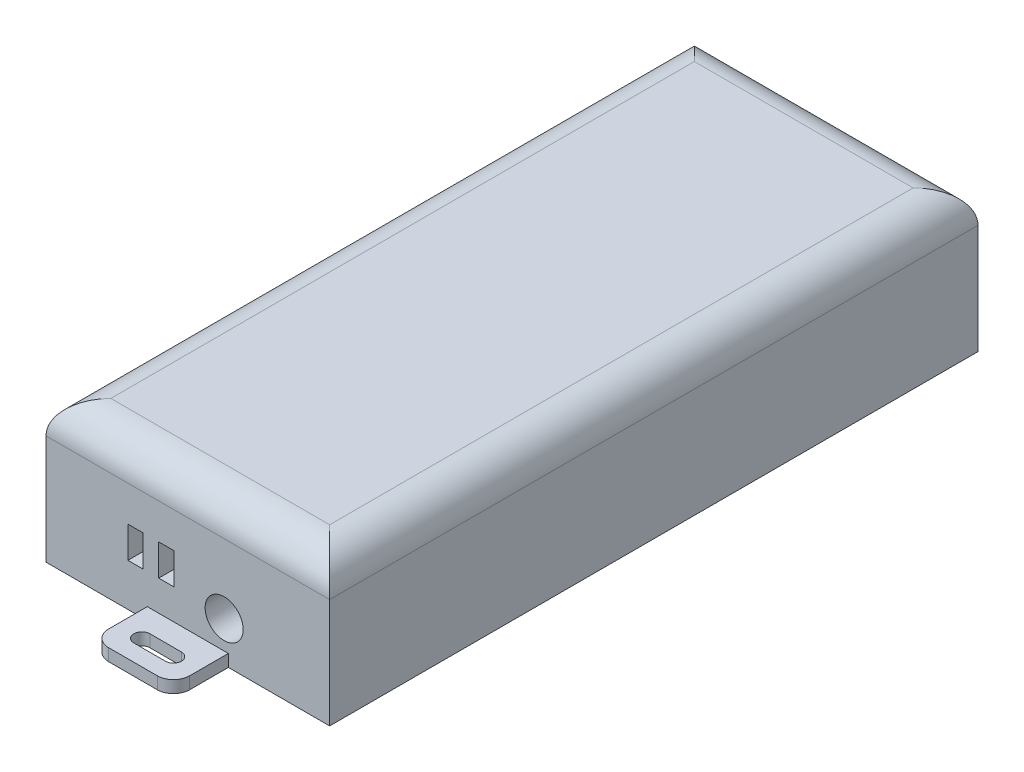
from build123d import *

# Parameters (mm, degrees)
SKETCH1_W           = 44.45
SKETCH1_H           = 101.6
BOSS_EXTRUDE1_DEPTH = 22.225
FILLET1_R           = 5.08
SKETCH2_R           = 2.981516586
CUT_EXTRUDE1_DEPTH  = 12.7
SKETCH3_W           = 2.38773998
SKETCH3_H           = 4.914706725
SKETCH3_W_2         = 2.387739981
CUT_EXTRUDE2_DEPTH  = 7.62
SKETCH4_W           = 3.327455713
SKETCH4_H           = 5.359264955
SKETCH4_W_2         = 3.327455714
CUT_EXTRUDE3_DEPTH  = 7.62
BOSS_EXTRUDE2_DEPTH = 1.905


with BuildPart() as part:
    # Sketch1 → Boss-Extrude1 (new body)
    with BuildSketch(Plane(origin=(0, 0, 0), x_dir=(1, 0, 0), z_dir=(0, 1, 0))):
        with Locations((22.225, 50.8)):
            Rectangle(SKETCH1_W, SKETCH1_H)
    extrude(amount=BOSS_EXTRUDE1_DEPTH)

    # Fillet1
    fillet1_edges = [part.edges().sort_by_distance(p)[0] for p in [
        (44.45, 22.225, -50.8),
        (22.225, 22.225, -101.6),
        (0, 22.225, -50.8),
        (22.225, 22.225, 0),
    ]]
    fillet(fillet1_edges, radius=FILLET1_R)

    # Sketch2 → Cut-Extrude1 (cut)
    with BuildSketch(Plane.XY):
        with Locations((27.915098323, 6.294196756)):
            Circle(SKETCH2_R)
    extrude(amount=-CUT_EXTRUDE1_DEPTH, mode=Mode.SUBTRACT)

    # Sketch3 → Cut-Extrude2 (cut)
    with BuildSketch(Plane.XY):
        with Locations((14.031826574, 9.129741005)):
            Rectangle(SKETCH3_W, SKETCH3_H)
        with Locations((18.859604577, 9.129741005)):
            Rectangle(SKETCH3_W_2, SKETCH3_H)
    extrude(amount=-CUT_EXTRUDE2_DEPTH, mode=Mode.SUBTRACT)

    # Sketch4 → Cut-Extrude3 (cut)
    with BuildSketch(Plane(origin=(0, 0, -101.6), x_dir=(-1, 0, 0), z_dir=(0, 0, -1))):
        with Locations((-29.15965328, 6.872202453)):
            Rectangle(SKETCH4_W, SKETCH4_H)
        with Locations((-24.536551093, 6.872202453)):
            Rectangle(SKETCH4_W_2, SKETCH4_H)
        with Locations((-19.913448907, 6.872202453)):
            Rectangle(SKETCH4_W_2, SKETCH4_H)
        with Locations((-15.290346721, 6.872202453)):
            Rectangle(SKETCH4_W, SKETCH4_H)
    extrude(amount=-CUT_EXTRUDE3_DEPTH, mode=Mode.SUBTRACT)

    # Sketch5 → Boss-Extrude2 (add)
    with BuildSketch(Plane.XZ):
        with BuildLine():
            Line((15.875, 0), (15.875, 6.058263516))
            ThreePointArc((15.875, 6.058263516), (16.618948776, 7.85431474), (18.415, 8.598263516))
            Line((18.415, 8.598263516), (26.035, 8.598263516))
            ThreePointArc((26.035, 8.598263516), (27.831051224, 7.85431474), (28.575, 6.058263516))
            Line((28.575, 6.058263516), (28.575, 0))
            Line((28.575, 0), (15.875, 0))
        make_face()
        with BuildLine():
            Line((19.751425895, 5.984747985), (24.698574105, 5.984747985))
            ThreePointArc((24.698574105, 5.984747985), (25.952772297, 4.730549793), (24.698574105, 3.476351601))
            Line((24.698574105, 3.476351601), (19.751425895, 3.476351601))
            ThreePointArc((19.751425895, 3.476351601), (18.497227703, 4.730549793), (19.751425895, 5.984747985))
        make_face(mode=Mode.SUBTRACT)
    boss_extrude2 = extrude(amount=-BOSS_EXTRUDE2_DEPTH)

    # Mirror2: Boss-Extrude2 across plane
    add(boss_extrude2.mirror(Plane.XY.offset(-49.738094236)))


solid = part.part
